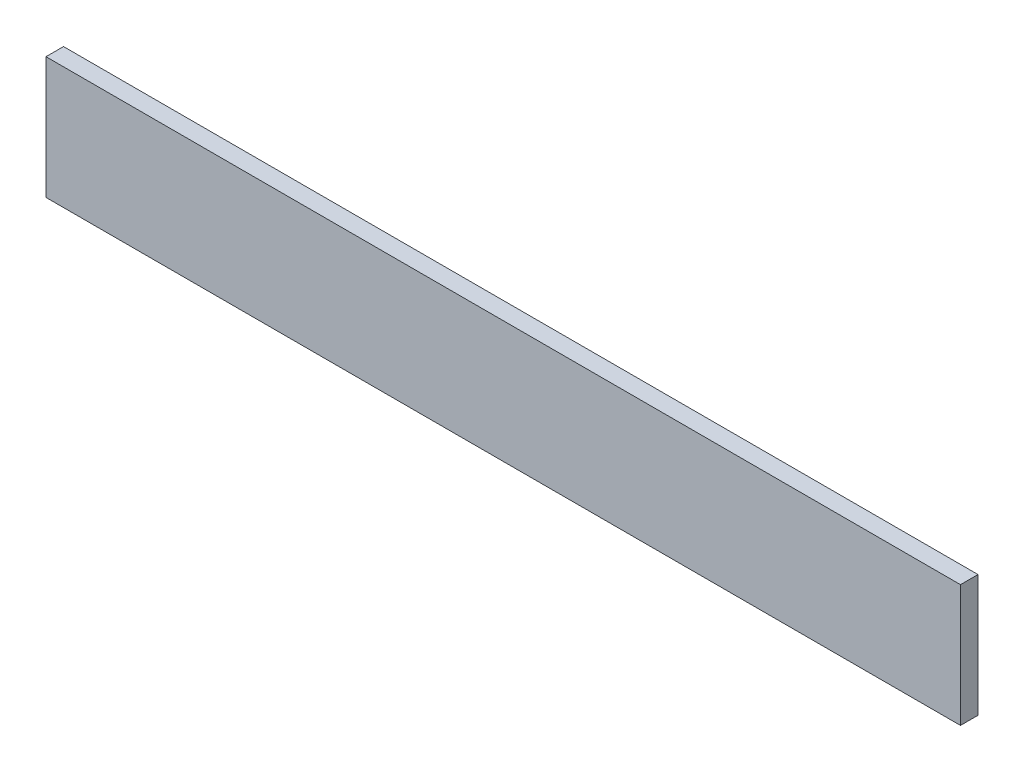
from build123d import *

# Parameters (mm, degrees)
SKETCH1_W           = 952.5
SKETCH1_H           = 127
BOSS_EXTRUDE1_DEPTH = 18.25625


with BuildPart() as part:
    # Sketch1 → Boss-Extrude1 (new body)
    with BuildSketch(Plane.XY):
        Rectangle(SKETCH1_W, SKETCH1_H)
    extrude(amount=BOSS_EXTRUDE1_DEPTH)


solid = part.part
